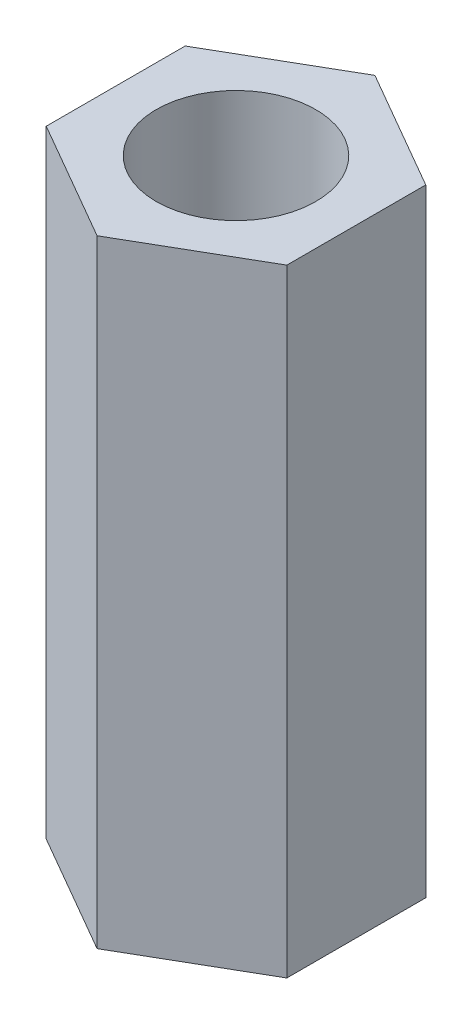
from build123d import *

# Parameters (mm, degrees)
SKETCH_1_R      = 1.55
EXTRUDE_1_DEPTH = 12


with BuildPart() as part:
    # 草图1 → 凸台-拉伸1 (new body)
    with BuildSketch(Plane(origin=(0, 0, 0), x_dir=(1, 0, 0), z_dir=(0, 1, 0))):
        Polygon((0, 2.7), (-2.33826859, 1.35), (-2.33826859, -1.35), (0, -2.7), (2.33826859, -1.35), (2.33826859, 1.35), align=None)
        with Locations(Location((0, 0, 0), (0, 0, 270))):
            Circle(SKETCH_1_R, mode=Mode.SUBTRACT)
    extrude(amount=EXTRUDE_1_DEPTH)


solid = part.part
